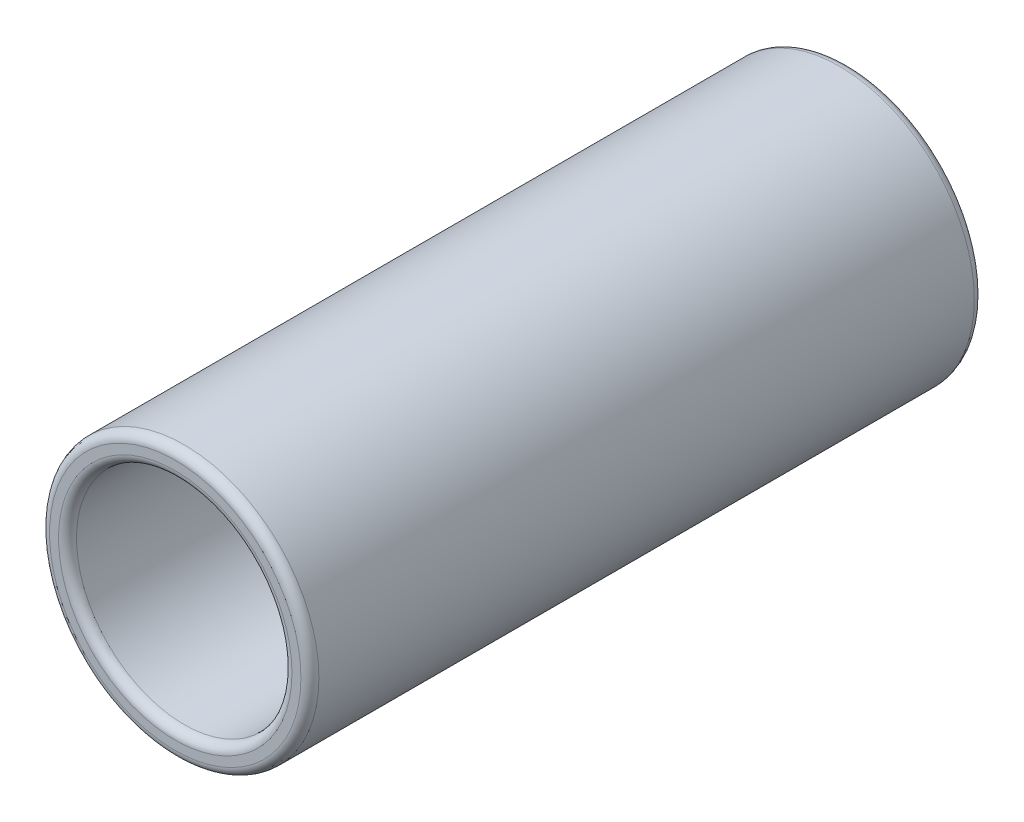
from build123d import *

# Parameters (mm, degrees)
SKETCH1_R           = 1.5
SKETCH1_R_2         = 1.2
BOSS_EXTRUDE1_DEPTH = 7.5
FILLET2_R           = 0.1


with BuildPart() as part:
    # Sketch1 → Boss-Extrude1 (new body)
    with BuildSketch(Plane.XY):
        Circle(SKETCH1_R)
        Circle(SKETCH1_R_2, mode=Mode.SUBTRACT)
    extrude(amount=BOSS_EXTRUDE1_DEPTH)

    # Fillet2
    fillet2_edges = [part.edges().sort_by_distance(p)[0] for p in [
        (-1.5, 0, 0),
        (-1.5, 0, 7.5),
        (-1.2, 0, 0),
        (-1.2, 0, 7.5),
    ]]
    fillet(fillet2_edges, radius=FILLET2_R)


solid = part.part
